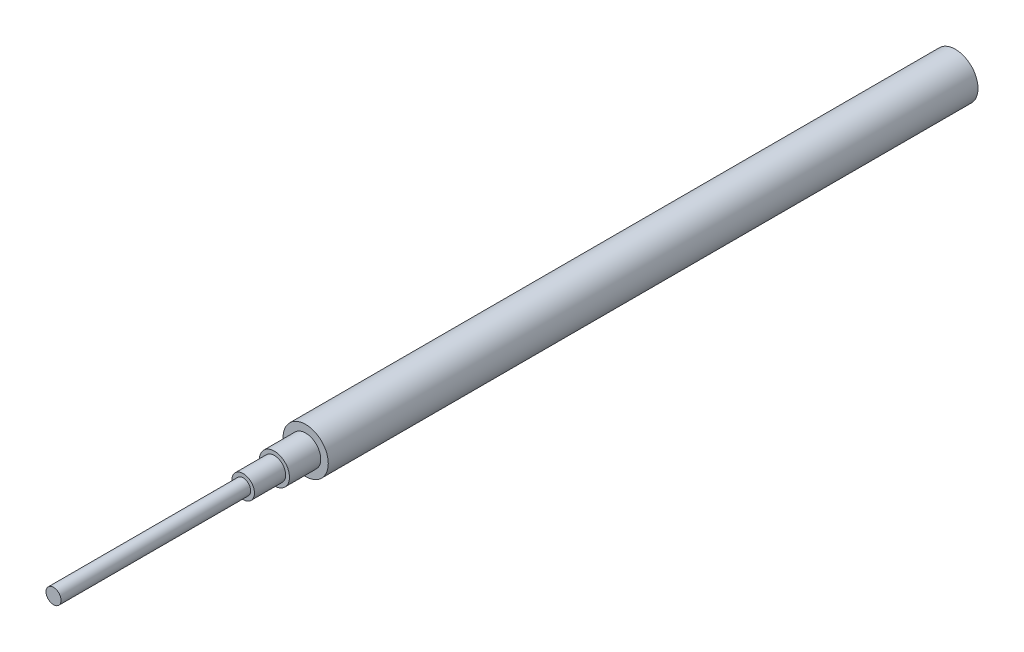
from build123d import *

# Parameters (mm, degrees)
SKETCH1_R           = 4.7625
BOSS_EXTRUDE1_DEPTH = 136.88
SKETCH2_R           = 3.175
BOSS_EXTRUDE2_DEPTH = 143.47
SKETCH3_R           = 2.38125
BOSS_EXTRUDE3_DEPTH = 150.05
SKETCH4_R           = 1.5875
BOSS_EXTRUDE4_DEPTH = 190


with BuildPart() as part:
    # Sketch1 → Boss-Extrude1 (new body)
    with BuildSketch(Plane.XY):
        Circle(SKETCH1_R)
    extrude(amount=BOSS_EXTRUDE1_DEPTH)

    # Sketch2 → Boss-Extrude2 (add)
    with BuildSketch(Plane.XY):
        Circle(SKETCH2_R)
    extrude(amount=BOSS_EXTRUDE2_DEPTH)

    # Sketch3 → Boss-Extrude3 (add)
    with BuildSketch(Plane.XY):
        Circle(SKETCH3_R)
    extrude(amount=BOSS_EXTRUDE3_DEPTH)

    # Sketch4 → Boss-Extrude4 (add)
    with BuildSketch(Plane.XY):
        Circle(SKETCH4_R)
    extrude(amount=BOSS_EXTRUDE4_DEPTH)


solid = part.part
